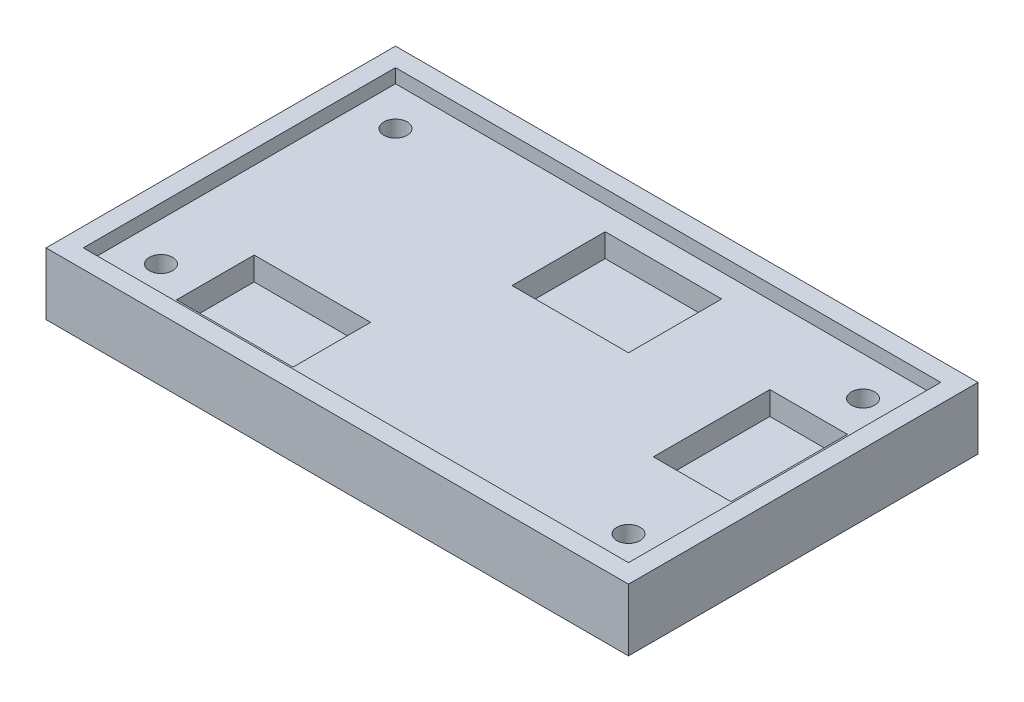
from build123d import *

# Parameters (mm, degrees)
SKETCH_2_W          = 75
SKETCH_2_H          = 45
EXTRUDE_3_DEPTH     = 8
SKETCH_5_W          = 70.2
SKETCH_5_H          = 40.2
CUT_EXTRUDE_1_DEPTH = 1.8
SKETCH_7_R          = 1.5
CUT_EXTRUDE_4_DEPTH = 2.2
SKETCH_8_W          = 15
SKETCH_8_H          = 10
SKETCH_8_W_2        = 10
SKETCH_8_H_2        = 15
SKETCH_8_H_3        = 12
CUT_EXTRUDE_6_DEPTH = 3


with BuildPart() as part:
    # 草图2 → 凸台-拉伸3 (new body)
    with BuildSketch(Plane(origin=(0, 0, 0), x_dir=(1, 0, 0), z_dir=(0, 1, 0))):
        with Locations((37.5, 22.5)):
            Rectangle(SKETCH_2_W, SKETCH_2_H)
    extrude(amount=EXTRUDE_3_DEPTH)

    # 草图5 → 切除-拉伸1 (cut)
    with BuildSketch(Plane(origin=(0, 8, 0), x_dir=(1, 0, 0), z_dir=(0, 1, 0))):
        with Locations((37.5, 22.5)):
            Rectangle(SKETCH_5_W, SKETCH_5_H)
    extrude(amount=-CUT_EXTRUDE_1_DEPTH, mode=Mode.SUBTRACT)

    # 草图7 → 切除-拉伸4 (cut)
    with BuildSketch(Plane(origin=(0, 6.2, 0), x_dir=(1, 0, 0), z_dir=(0, 1, 0))):
        with Locations(Location((7.4, 37.6, 0), (0, 0, 270))):
            Circle(SKETCH_7_R)
        with Locations(Location((67.6, 37.6, 0), (0, 0, 90))):
            Circle(SKETCH_7_R)
        with Locations(Location((7.4, 7.4, 0), (0, 0, 90))):
            Circle(SKETCH_7_R)
        with Locations(Location((67.6, 7.4, 0), (0, 0, 270))):
            Circle(SKETCH_7_R)
    extrude(amount=-CUT_EXTRUDE_4_DEPTH, mode=Mode.SUBTRACT)

    # 草图8 → 切除-拉伸6 (cut)
    with BuildSketch(Plane(origin=(0, 6.2, 0), x_dir=(1, 0, 0), z_dir=(0, 1, 0))):
        with Locations((19.9, 9.4)):
            Rectangle(SKETCH_8_W, SKETCH_8_H)
        with Locations((65.6, 25.1)):
            Rectangle(SKETCH_8_W_2, SKETCH_8_H_2)
        with Locations((39.9, 33.6)):
            Rectangle(SKETCH_8_W, SKETCH_8_H_3)
    extrude(amount=-CUT_EXTRUDE_6_DEPTH, mode=Mode.SUBTRACT)


solid = part.part
